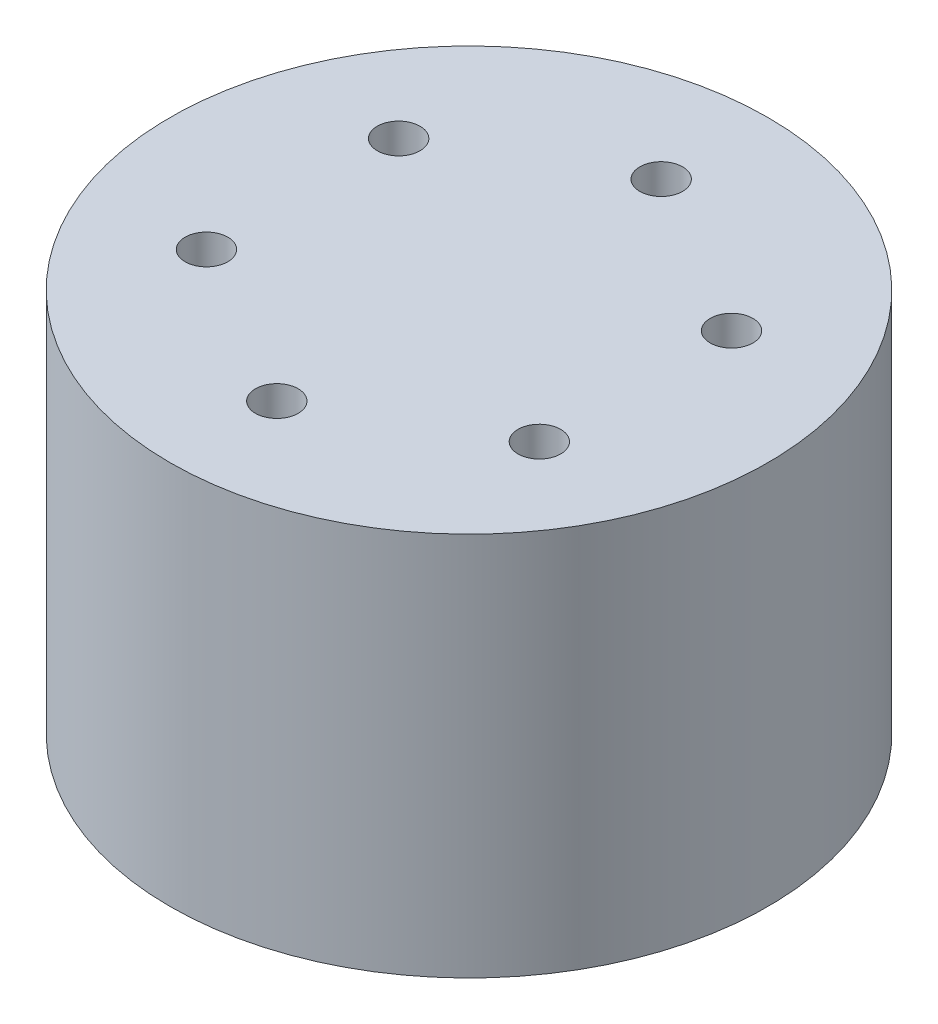
from build123d import *

# Parameters (mm, degrees)
SKETCH1_R           = 35
SKETCH1_R_2         = 5
SKETCH1_R_3         = 2.5
BOSS_EXTRUDE1_DEPTH = 45
SKETCH2_R           = 16
CUT_EXTRUDE1_DEPTH  = 5
SKETCH5_R           = 13
CUT_EXTRUDE2_DEPTH  = 40
SKETCH6_R           = 13
BOSS_EXTRUDE2_DEPTH = 18


with BuildPart() as part:
    # Sketch1 → Boss-Extrude1 (new body)
    with BuildSketch(Plane(origin=(0, 0, 0), x_dir=(1, 0, 0), z_dir=(0, 1, 0))):
        with Locations(Location((0, 0, 0), (0, 0, 90))):
            Circle(SKETCH1_R)
        with Locations(Location((0, 0, 0), (0, 0, 90))):
            Circle(SKETCH1_R_2, mode=Mode.SUBTRACT)
        with Locations(Location((0, 22.5, 0), (0, 0, 90))):
            Circle(SKETCH1_R_3, mode=Mode.SUBTRACT)
        with Locations(Location((19.485571585, 11.25, 0), (0, 0, 90))):
            Circle(SKETCH1_R_3, mode=Mode.SUBTRACT)
        with Locations(Location((19.485571585, -11.25, 0), (0, 0, 90))):
            Circle(SKETCH1_R_3, mode=Mode.SUBTRACT)
        with Locations(Location((0, -22.5, 0), (0, 0, 90))):
            Circle(SKETCH1_R_3, mode=Mode.SUBTRACT)
        with Locations(Location((-19.485571585, -11.25, 0), (0, 0, 90))):
            Circle(SKETCH1_R_3, mode=Mode.SUBTRACT)
        with Locations(Location((-19.485571585, 11.25, 0), (0, 0, 90))):
            Circle(SKETCH1_R_3, mode=Mode.SUBTRACT)
    extrude(amount=BOSS_EXTRUDE1_DEPTH)

    # Sketch2 → Cut-Extrude1 (cut)
    with BuildSketch(Plane.XZ):
        with Locations(Location((0, 0, 0), (0, 0, 270))):
            Circle(SKETCH2_R)
    extrude(amount=-CUT_EXTRUDE1_DEPTH, mode=Mode.SUBTRACT)

    # Sketch5 → Cut-Extrude2 (cut)
    with BuildSketch(Plane(origin=(0, 45, 0), x_dir=(1, 0, 0), z_dir=(0, 1, 0))):
        with Locations(Location((0, 0, 0), (0, 0, 270))):
            Circle(SKETCH5_R)
    extrude(amount=-CUT_EXTRUDE2_DEPTH, mode=Mode.SUBTRACT)

    # Sketch6 → Boss-Extrude2 (add)
    with BuildSketch(Plane(origin=(0, 45, 0), x_dir=(1, 0, 0), z_dir=(0, 1, 0))):
        with Locations(Location((0, 0, 0), (0, 0, 270))):
            Circle(SKETCH6_R)
    extrude(amount=-BOSS_EXTRUDE2_DEPTH)


solid = part.part
